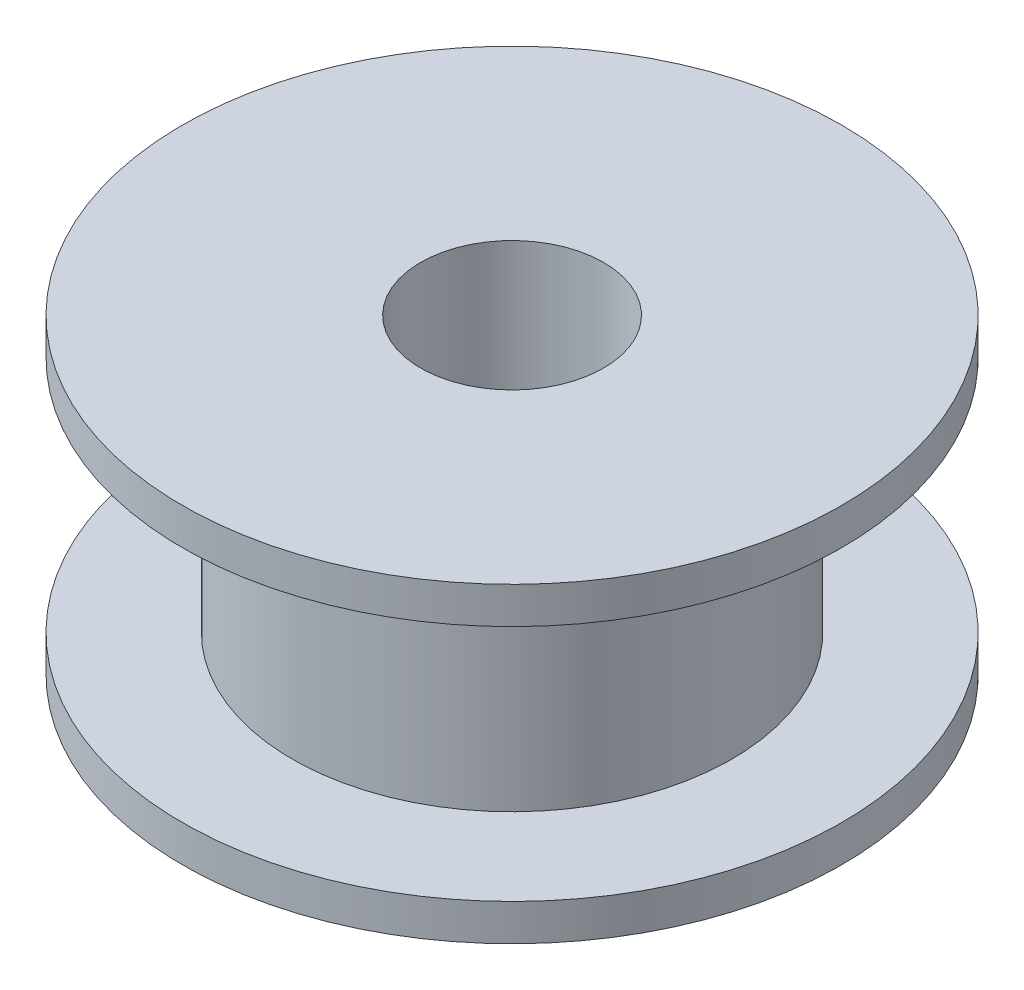
from build123d import *


with BuildPart() as part:
    # Skica1 → Rotovat1 (revolve)
    with BuildSketch(Plane.XY, mode=Mode.PRIVATE) as rotovat1_sk:
        Polygon((-9, 2.21793537), (-9, 3.21793537), (-6, 3.21793537), (-6, 9.71793537), (-9, 9.71793537), (-9, 10.71793537), (-2.5, 10.71793537), (-2.5, 2.21793537), align=None)
    revolve(rotovat1_sk.sketch.rotate(Axis((0, 0, 0), (0, 1, 0)), 270), axis=Axis((0, 0, 0), (0, 1, 0)))


solid = part.part
